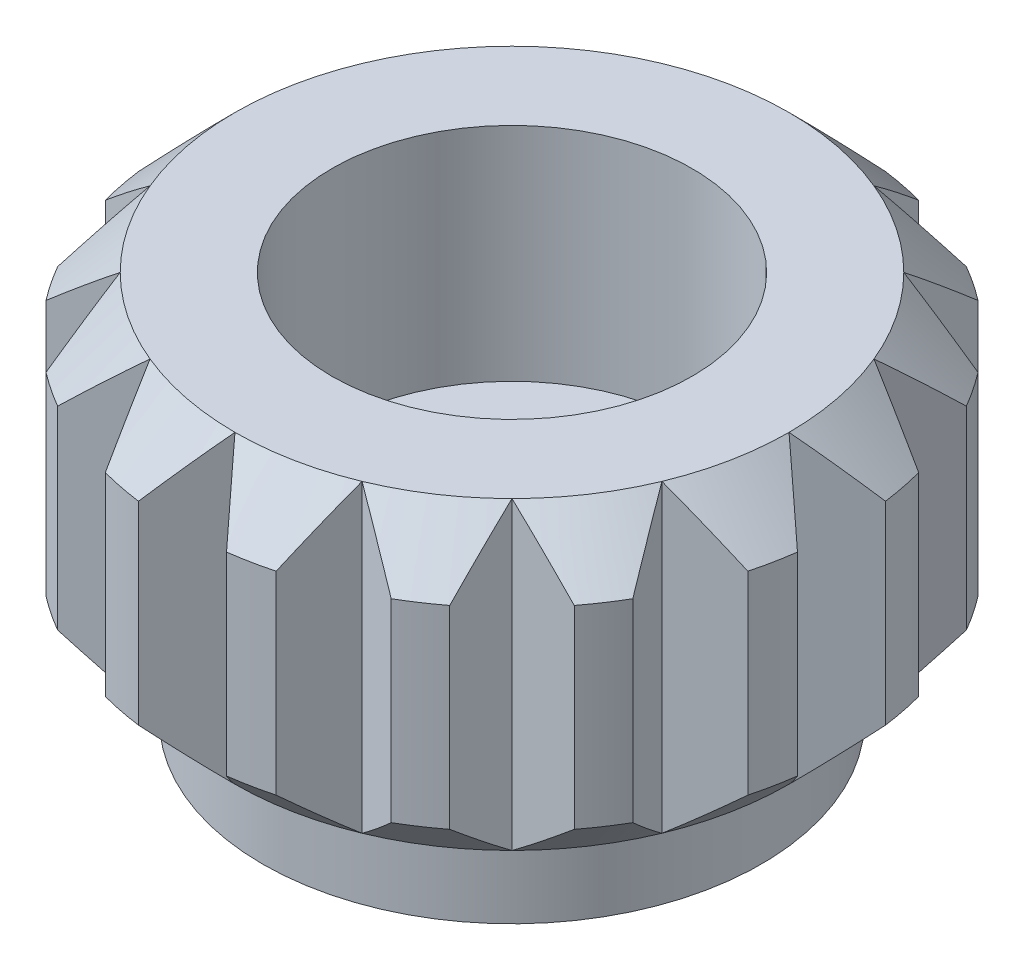
from build123d import *

# Parameters (mm, degrees)
ESQUISSE1_R                                     = 6
BOSS_EXTRU_1_DEPTH                              = 7
ESQUISSE2_OUTSIDE_W                             = 17.672
ESQUISSE2_OUTSIDE_H                             = 17.672
ESQUISSE2_OUTSIDE_R                             = 4.5
ENL_V_MAT_EXTRU_1_DEPTH                         = 1.5
CHANFREIN1_SIZE                                 = 1
CHAMBRAGE_POUR_VIS_T_TE_CYLINDRIQUE_D           = 3.2
CHAMBRAGE_POUR_VIS_T_TE_CYLINDRIQUE_CBORE_D     = 6.5
CHAMBRAGE_POUR_VIS_T_TE_CYLINDRIQUE_CBORE_DEPTH = 4
ENL_V_MAT_EXTRU_2_DEPTH                         = 12
R_P_TITION_CIRCULAIRE1_COUNT                    = 16


with BuildPart() as part:
    # Esquisse1 → Boss.-Extru.1 (new body)
    with BuildSketch(Plane(origin=(0, 0, 0), x_dir=(1, 0, 0), z_dir=(0, 1, 0))):
        with Locations(Location((0, 0, 0), (0, 0, 270))):
            Circle(ESQUISSE1_R)
    extrude(amount=BOSS_EXTRU_1_DEPTH)

    # Esquisse2 outside → Enlèv. mat.-Extru.1 (cut)
    with BuildSketch(Plane.XZ):
        Rectangle(ESQUISSE2_OUTSIDE_W, ESQUISSE2_OUTSIDE_H)
        with Locations(Location((0, 0, 0), (0, 0, 270))):
            Circle(ESQUISSE2_OUTSIDE_R, mode=Mode.SUBTRACT)
    extrude(amount=-ENL_V_MAT_EXTRU_1_DEPTH, mode=Mode.SUBTRACT)

    # Chanfrein1
    chanfrein1_edges = [part.edges().sort_by_distance(p)[0] for p in [
        (0, 7, -6),
        (0, 1.5, -6),
    ]]
    chamfer(chanfrein1_edges, length=CHANFREIN1_SIZE)

    # Chambrage pour vis à tête cylindrique à 6 pans creux (ou vis CHC) M31 (through all)
    with Locations(Plane(origin=(0, 7, 0), x_dir=(1, 0, 0), z_dir=(0, 1, 0))):
        with Locations((0, 0)):
            CounterBoreHole(CHAMBRAGE_POUR_VIS_T_TE_CYLINDRIQUE_D / 2, CHAMBRAGE_POUR_VIS_T_TE_CYLINDRIQUE_CBORE_D / 2, CHAMBRAGE_POUR_VIS_T_TE_CYLINDRIQUE_CBORE_DEPTH)

    # Esquisse5 → Enlèv. mat.-Extru.2 (cut, through all)
    with BuildSketch(Plane(origin=(0, 7, 0), x_dir=(1, 0, 0), z_dir=(0, 1, 0))):
        Polygon((-5, 0), (-6.645642825, 1.380858287), (-6.645642825, -1.380858287), align=None)
    enl_v_mat_extru_2 = extrude(amount=-ENL_V_MAT_EXTRU_2_DEPTH, mode=Mode.SUBTRACT)

    # Répétition circulaire1: Enlèv. mat.-Extru.2 ×16 about axis
    r_p_tition_circulaire1_axis = Axis((0, 0, 0), (0, 1, 0))
    for i in range(1, R_P_TITION_CIRCULAIRE1_COUNT):
        add(enl_v_mat_extru_2.rotate(r_p_tition_circulaire1_axis, i * 360 / R_P_TITION_CIRCULAIRE1_COUNT), mode=Mode.SUBTRACT)


solid = part.part
